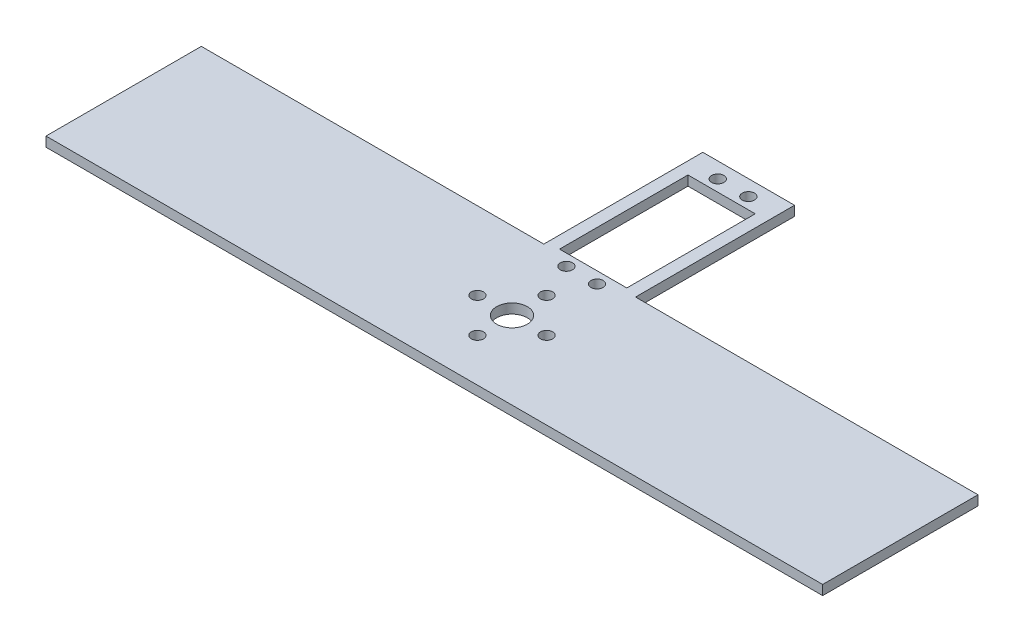
from build123d import *

# Parameters (mm, degrees)
SKETCH1_R           = 2
SKETCH1_R_2         = 5
BOSS_EXTRUDE1_DEPTH = 3.175


with BuildPart() as part:
    # Sketch1 → Boss-Extrude1 (new body)
    with BuildSketch(Plane(origin=(0, 0, 0), x_dir=(1, 0, 0), z_dir=(0, 1, 0))):
        Polygon((254, 0), (142, 0), (142, 52), (112, 52), (112, 0), (0, 0), (0, -50.8), (254, -50.8), align=None)
        with Locations(Location((127, -36.713708499, 0), (0, 0, 270))):
            Circle(SKETCH1_R, mode=Mode.SUBTRACT)
        with Locations(Location((115.686291501, -25.4, 0), (0, 0, 270))):
            Circle(SKETCH1_R, mode=Mode.SUBTRACT)
        with Locations(Location((127, -25.4, 0), (0, 0, 270))):
            Circle(SKETCH1_R_2, mode=Mode.SUBTRACT)
        with Locations(Location((138.313708499, -25.4, 0), (0, 0, 270))):
            Circle(SKETCH1_R, mode=Mode.SUBTRACT)
        with Locations(Location((122, -2.6025933, 0), (0, 0, 270))):
            Circle(SKETCH1_R, mode=Mode.SUBTRACT)
        with Locations(Location((127, -14.086291501, 0), (0, 0, 270))):
            Circle(SKETCH1_R, mode=Mode.SUBTRACT)
        with Locations(Location((132, -2.6025933, 0), (0, 0, 270))):
            Circle(SKETCH1_R, mode=Mode.SUBTRACT)
        Polygon((138, 1.1474067), (127, 1.1474067), (116, 1.1474067), (116, 43.1474067), (127, 43.1474067), (138, 43.1474067), align=None, mode=Mode.SUBTRACT)
        with Locations(Location((122, 46.8974067, 0), (0, 0, 270))):
            Circle(SKETCH1_R, mode=Mode.SUBTRACT)
        with Locations(Location((132, 46.8974067, 0), (0, 0, 270))):
            Circle(SKETCH1_R, mode=Mode.SUBTRACT)
    extrude(amount=BOSS_EXTRUDE1_DEPTH)


solid = part.part
